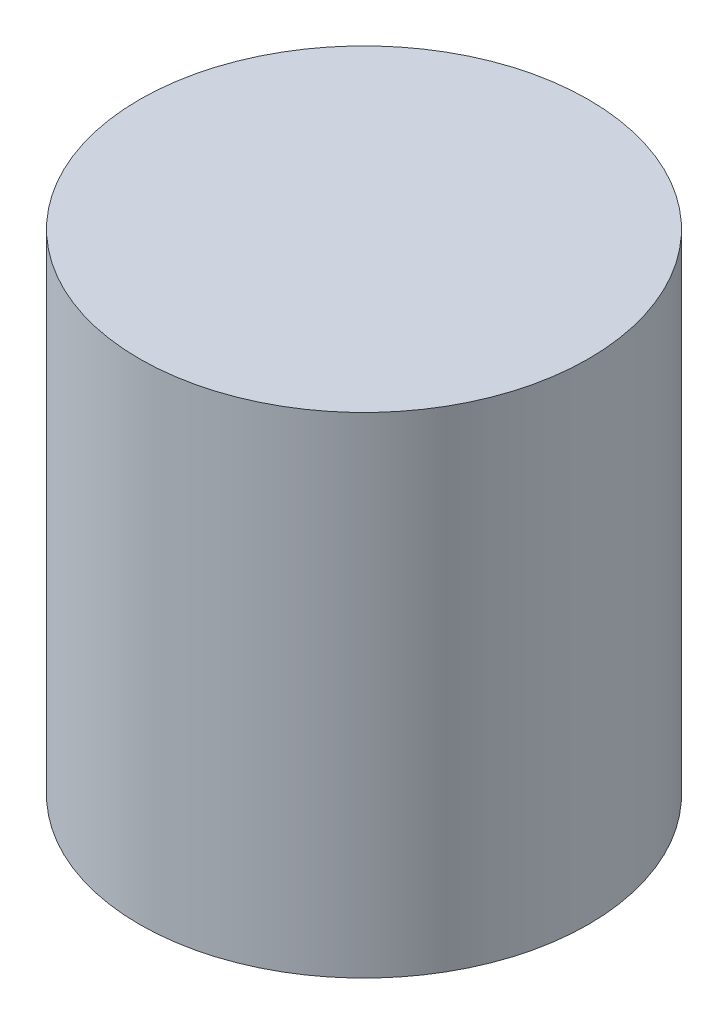
from build123d import *

# Parameters (mm, degrees)
SKETCH1_R           = 5.5
BOSS_EXTRUDE1_DEPTH = 12
SKETCH2_R           = 3
CUT_EXTRUDE1_DEPTH  = 5


with BuildPart() as part:
    # Sketch1 → Boss-Extrude1 (new body)
    with BuildSketch(Plane(origin=(0, 0, 0), x_dir=(1, 0, 0), z_dir=(0, 1, 0))):
        with Locations(Location((0, 0, 0), (0, 0, 270))):
            Circle(SKETCH1_R)
    extrude(amount=BOSS_EXTRUDE1_DEPTH)

    # Sketch2 → Cut-Extrude1 (cut)
    with BuildSketch(Plane.XZ):
        with Locations(Location((0, 0, 0), (0, 0, 270))):
            Circle(SKETCH2_R)
    extrude(amount=-CUT_EXTRUDE1_DEPTH, mode=Mode.SUBTRACT)


solid = part.part
